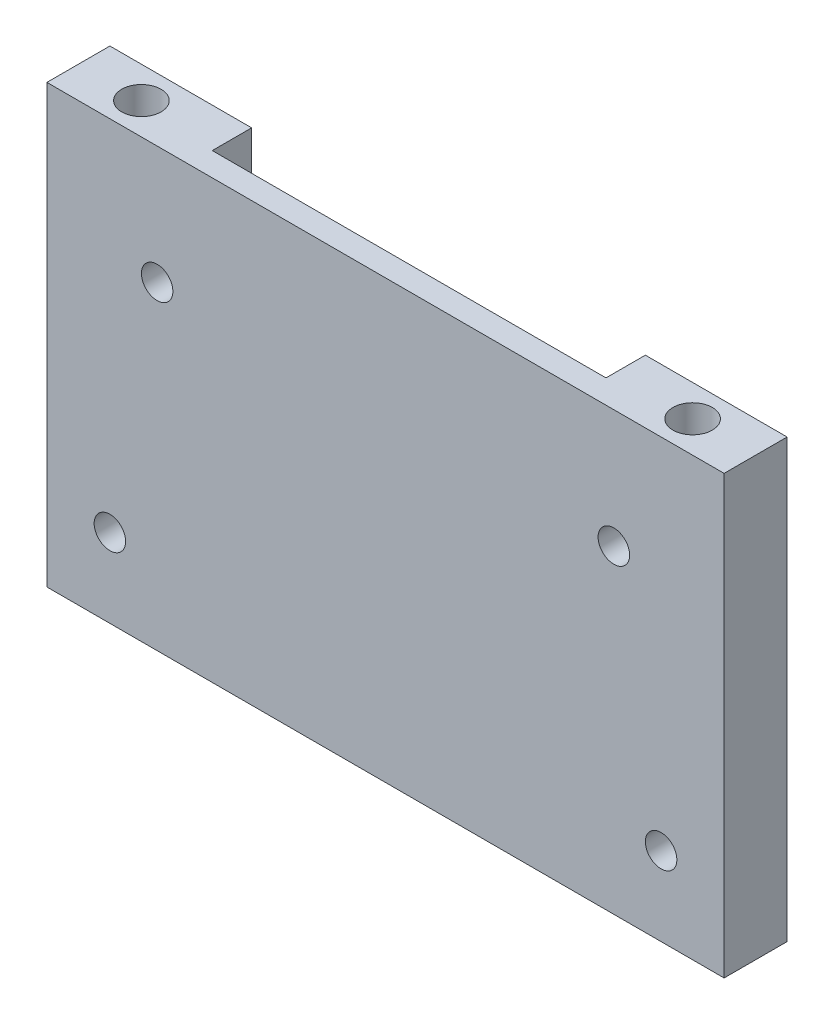
from build123d import *

# Parameters (mm, degrees)
SKETCH_1_W          = 86
SKETCH_1_H          = 55.5
EXTRUDE_1_DEPTH     = 8
SKETCH_2_R          = 2.5
CUT_EXTRUDE_1_DEPTH = 25
SKETCH_3_W          = 50
SKETCH_3_H          = 55.5
CUT_EXTRUDE_2_DEPTH = 5
SKETCH_4_R          = 2
CUT_EXTRUDE_3_DEPTH = 103.665719693


with BuildPart() as part:
    # 草图1 → 拉伸1 (new body)
    with BuildSketch(Plane.XY):
        with Locations((43, 27.75)):
            Rectangle(SKETCH_1_W, SKETCH_1_H)
    extrude(amount=EXTRUDE_1_DEPTH)

    # 草图2 → 切除-拉伸1 (cut)
    with BuildSketch(Plane(origin=(0, 55.5, 0), x_dir=(-1, 0, 0), z_dir=(0, 1, 0))):
        with Locations(Location((-78, 4, 0), (0, 0, 90))):
            Circle(SKETCH_2_R)
        with Locations(Location((-8, 4, 0), (0, 0, 90))):
            Circle(SKETCH_2_R)
    extrude(amount=-CUT_EXTRUDE_1_DEPTH, mode=Mode.SUBTRACT)

    # 草图3 → 切除-拉伸2 (cut)
    with BuildSketch(Plane(origin=(0, 0, 0), x_dir=(-1, 0, 0), z_dir=(0, 0, -1))):
        with Locations((-43, 27.75)):
            Rectangle(SKETCH_3_W, SKETCH_3_H)
    extrude(amount=-CUT_EXTRUDE_2_DEPTH, mode=Mode.SUBTRACT)

    # 草图4 → 切除-拉伸3 (cut, through all)
    with BuildSketch(Plane(origin=(0, 0, 0), x_dir=(-1, 0, 0), z_dir=(0, 0, -1))):
        with Locations((-72, 40.5)):
            Circle(SKETCH_4_R)
        with Locations((-78, 10)):
            Circle(SKETCH_4_R)
        with Locations((-14, 40.5)):
            Circle(SKETCH_4_R)
        with Locations((-8, 10)):
            Circle(SKETCH_4_R)
    extrude(amount=-CUT_EXTRUDE_3_DEPTH, mode=Mode.SUBTRACT)


solid = part.part
